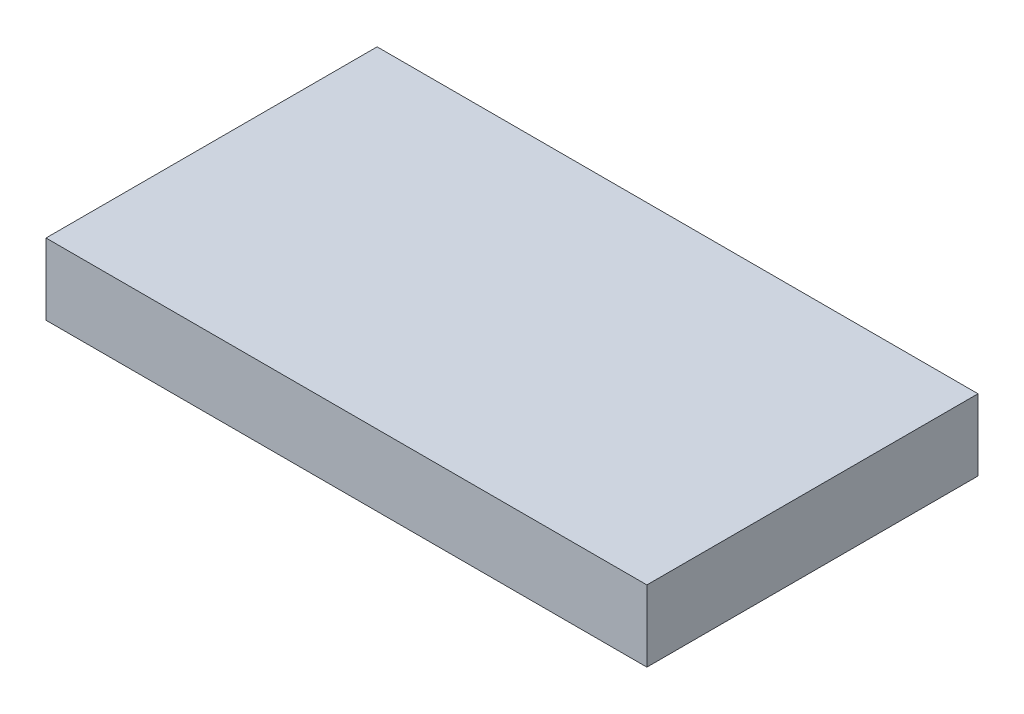
from build123d import *

# Parameters (mm, degrees)
SKETCH_1_W             = 84.342821298
SKETCH_1_H             = 46.47466386
EXTRUDE_1_DEPTH        = 10
PATTERN_LINEAR_3_COUNT = 4
PATTERN_LINEAR_3_PITCH = 10
PATTERN_LINEAR_4_COUNT = 4
PATTERN_LINEAR_4_PITCH = 10
PATTERN_LINEAR_5_COUNT = 4
PATTERN_LINEAR_5_PITCH = 10
PATTERN_LINEAR_6_COUNT = 4
PATTERN_LINEAR_6_PITCH = 10


with BuildPart() as part:
    # 스케치1 → 보스-돌출1 (new body)
    with BuildSketch(Plane(origin=(0, 0, 0), x_dir=(1, 0, 0), z_dir=(0, 1, 0))):
        Rectangle(SKETCH_1_W, SKETCH_1_H)
    extrude(amount=EXTRUDE_1_DEPTH)

    # 스케치5 → 컷-회전3 (revolve, cut)
    with BuildSketch(Plane.XY):
        with BuildLine():
            Line((0, -2.5), (0, 2.5))
            ThreePointArc((0, 2.5), (-2.5, 0), (0, -2.5))
        make_face()
    cut_revolve_3 = revolve(axis=Axis((0, -2.5, 0), (0, 1, 0)), mode=Mode.SUBTRACT)

    # 선형 패턴3: 컷-회전3 ×4
    with Locations(*[(-i * PATTERN_LINEAR_3_PITCH, 0, 0) for i in range(1, PATTERN_LINEAR_3_COUNT)]):
        add(cut_revolve_3, mode=Mode.SUBTRACT)

    # 선형 패턴4: 컷-회전3 ×4
    with Locations(*[(i * PATTERN_LINEAR_4_PITCH, 0, 0) for i in range(1, PATTERN_LINEAR_4_COUNT)]):
        add(cut_revolve_3, mode=Mode.SUBTRACT)

    # 스케치8 → 컷-회전4 (revolve, cut)
    with BuildSketch(Plane.XY.offset(15)):
        with BuildLine():
            Line((0, 2.5), (0, -2.5))
            ThreePointArc((0, -2.5), (-2.5, 0), (0, 2.5))
        make_face()
    cut_revolve_4 = revolve(axis=Axis((0, 2.5, 15), (0, -1, 0)), mode=Mode.SUBTRACT)

    # 선형 패턴5: 컷-회전4 ×4
    with Locations(*[(i * PATTERN_LINEAR_5_PITCH, 0, 0) for i in range(1, PATTERN_LINEAR_5_COUNT)]):
        add(cut_revolve_4, mode=Mode.SUBTRACT)

    # 선형 패턴6: 컷-회전4 ×4
    with Locations(*[(-i * PATTERN_LINEAR_6_PITCH, 0, 0) for i in range(1, PATTERN_LINEAR_6_COUNT)]):
        add(cut_revolve_4, mode=Mode.SUBTRACT)

    # 대칭 복사1: 컷-회전4 across plane
    add(cut_revolve_4.mirror(Plane.XY), mode=Mode.SUBTRACT)

    # 대칭 복사1 copy 1 sketch → 대칭 복사1 copy 1 (revolve, cut)
    with BuildSketch(Plane(origin=(10, 0, -15), x_dir=(1, 0, 0), z_dir=(0, 0, -1))):
        with BuildLine():
            Line((0, -2.5), (0, 2.5))
            ThreePointArc((0, 2.5), (-2.5, 0), (0, -2.5))
        make_face()
    revolve(axis=Axis((10, 2.5, -15), (0, 1, 0)), mode=Mode.SUBTRACT)

    # 대칭 복사1 copy 2 sketch → 대칭 복사1 copy 2 (revolve, cut)
    with BuildSketch(Plane(origin=(20, 0, -15), x_dir=(1, 0, 0), z_dir=(0, 0, -1))):
        with BuildLine():
            Line((0, -2.5), (0, 2.5))
            ThreePointArc((0, 2.5), (-2.5, 0), (0, -2.5))
        make_face()
    revolve(axis=Axis((20, 2.5, -15), (0, 1, 0)), mode=Mode.SUBTRACT)

    # 대칭 복사1 copy 3 sketch → 대칭 복사1 copy 3 (revolve, cut)
    with BuildSketch(Plane(origin=(30, 0, -15), x_dir=(1, 0, 0), z_dir=(0, 0, -1))):
        with BuildLine():
            Line((0, -2.5), (0, 2.5))
            ThreePointArc((0, 2.5), (-2.5, 0), (0, -2.5))
        make_face()
    revolve(axis=Axis((30, 2.5, -15), (0, 1, 0)), mode=Mode.SUBTRACT)

    # 대칭 복사1 copy 4 sketch → 대칭 복사1 copy 4 (revolve, cut)
    with BuildSketch(Plane(origin=(-10, 0, -15), x_dir=(1, 0, 0), z_dir=(0, 0, -1))):
        with BuildLine():
            Line((0, -2.5), (0, 2.5))
            ThreePointArc((0, 2.5), (-2.5, 0), (0, -2.5))
        make_face()
    revolve(axis=Axis((-10, 2.5, -15), (0, 1, 0)), mode=Mode.SUBTRACT)

    # 대칭 복사1 copy 5 sketch → 대칭 복사1 copy 5 (revolve, cut)
    with BuildSketch(Plane(origin=(-20, 0, -15), x_dir=(1, 0, 0), z_dir=(0, 0, -1))):
        with BuildLine():
            Line((0, -2.5), (0, 2.5))
            ThreePointArc((0, 2.5), (-2.5, 0), (0, -2.5))
        make_face()
    revolve(axis=Axis((-20, 2.5, -15), (0, 1, 0)), mode=Mode.SUBTRACT)

    # 대칭 복사1 copy 6 sketch → 대칭 복사1 copy 6 (revolve, cut)
    with BuildSketch(Plane(origin=(-30, 0, -15), x_dir=(1, 0, 0), z_dir=(0, 0, -1))):
        with BuildLine():
            Line((0, -2.5), (0, 2.5))
            ThreePointArc((0, 2.5), (-2.5, 0), (0, -2.5))
        make_face()
    revolve(axis=Axis((-30, 2.5, -15), (0, 1, 0)), mode=Mode.SUBTRACT)


solid = part.part
